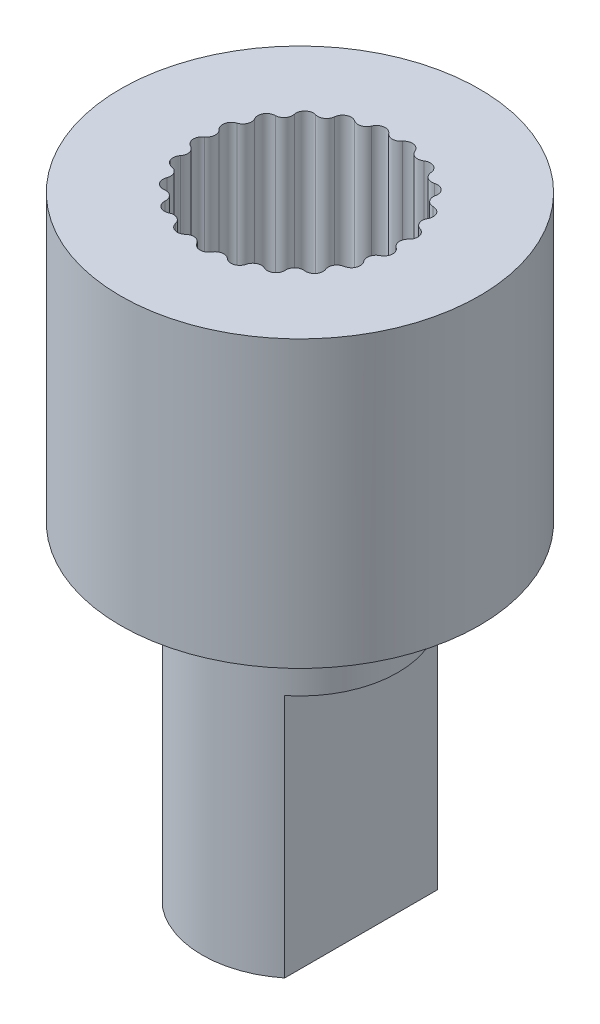
from build123d import *

# Parameters (mm, degrees)
SKETCH1_R           = 3.95
BOSS_EXTRUDE1_DEPTH = 5
SKETCH2_R           = 4.4
BOSS_EXTRUDE2_DEPTH = 2
SKETCH4_R           = 2.4
BOSS_EXTRUDE3_DEPTH = 2
BOSS_EXTRUDE4_DEPTH = 6
SKETCH6_R           = 4.4
SKETCH6_R_2         = 3.95
BOSS_EXTRUDE5_DEPTH = 5


with BuildPart() as part:
    # Sketch1 → Boss-Extrude1 (new body)
    with BuildSketch(Plane(origin=(0, 0, 0), x_dir=(1, 0, 0), z_dir=(0, 1, 0))):
        with Locations(Location((0, 0, 0), (0, 0, 270))):
            Circle(SKETCH1_R)
        with BuildLine():
            ThreePointArc((-0.166646614, 2.345141313), (-0.092401566, 2.286261662), (0, 2.2652595))
            ThreePointArc((0, 2.2652595), (0.092401566, 2.286261662), (0.166646614, 2.345141313))
            ThreePointArc((0.166646614, 2.345141313), (0.365153552, 2.422635524), (0.531999564, 2.290073216))
            ThreePointArc((0.531999564, 2.290073216), (0.585591031, 2.211925311), (0.667696959, 2.164620376))
            ThreePointArc((0.667696959, 2.164620376), (0.762183879, 2.157453631), (0.850485509, 2.191833312))
            ThreePointArc((0.850485509, 2.191833312), (1.063015161, 2.207373726), (1.183375246, 2.031522064))
            ThreePointArc((1.183375246, 2.031522064), (1.211551295, 1.941049689), (1.276066113, 1.871645232))
            ThreePointArc((1.276066113, 1.871645232), (1.364242809, 1.836946378), (1.458755034, 1.843771303))
            ThreePointArc((1.458755034, 1.843771303), (1.666423208, 1.795977086), (1.729602845, 1.592461261))
            ThreePointArc((1.729602845, 1.592461261), (1.72985991, 1.497703284), (1.771051193, 1.412366197))
            ThreePointArc((1.771051193, 1.412366197), (1.845082779, 1.353218377), (1.937407773, 1.331882123))
            ThreePointArc((1.937407773, 1.331882123), (2.121762239, 1.225), (2.12214764, 1.011903287))
            ThreePointArc((2.12214764, 1.011903287), (2.094462881, 0.92127937), (2.108670602, 0.827592226))
            ThreePointArc((2.108670602, 0.827592226), (2.161979047, 0.749250985), (2.243913329, 0.701649371))
            ThreePointArc((2.243913329, 0.701649371), (2.388573385, 0.545176288), (2.326130305, 0.341433266))
            ThreePointArc((2.326130305, 0.341433266), (2.272963633, 0.262995741), (2.258925375, 0.169283054))
            ThreePointArc((2.258925375, 0.169283054), (2.286773988, 0.078709355), (2.351037339, 0.009071994))
            ThreePointArc((2.351037339, 0.009071994), (2.443149303, -0.183088729), (2.323426084, -0.3593746))
            ThreePointArc((2.323426084, -0.3593746), (2.249501592, -0.418656214), (2.208464714, -0.504067659))
            ThreePointArc((2.208464714, -0.504067659), (2.208379026, -0.598825947), (2.249261363, -0.68431147))
            ThreePointArc((2.249261363, -0.68431147), (2.280640684, -0.89508551), (2.114275259, -1.028250455))
            ThreePointArc((2.114275259, -1.028250455), (2.026161462, -1.063108727), (1.961772273, -1.13262975))
            ThreePointArc((1.961772273, -1.13262975), (1.933759896, -1.223152935), (1.947628645, -1.316890857))
            ThreePointArc((1.947628645, -1.316890857), (1.915487132, -1.527550015), (1.717261799, -1.605761745))
            ThreePointArc((1.717261799, -1.605761745), (1.622787995, -1.613099364), (1.540767756, -1.660552716))
            ThreePointArc((1.540767756, -1.660552716), (1.487317713, -1.738797417), (1.472940575, -1.832458712))
            ThreePointArc((1.472940575, -1.832458712), (1.380134142, -2.024284997), (1.167662092, -2.040594058))
            ThreePointArc((1.167662092, -2.040594058), (1.075222693, -2.019759044), (0.982859262, -2.040928287))
            ThreePointArc((0.982859262, -2.040928287), (0.908720824, -2.099942118), (0.86737527, -2.185204569))
            ThreePointArc((0.86737527, -2.185204569), (0.722150177, -2.341153374), (0.514310485, -2.294110633))
            ThreePointArc((0.514310485, -2.294110633), (0.432119136, -2.246954269), (0.337619409, -2.239958423))
            ThreePointArc((0.337619409, -2.239958423), (0.249380102, -2.274497747), (0.184739867, -2.343785411))
            ThreePointArc((0.184739867, -2.343785411), (0, -2.45), (-0.184739867, -2.343785411))
            ThreePointArc((-0.184739867, -2.343785411), (-0.249380102, -2.274497747), (-0.337619409, -2.239958423))
            ThreePointArc((-0.337619409, -2.239958423), (-0.432119136, -2.246954269), (-0.514310485, -2.294110633))
            ThreePointArc((-0.514310485, -2.294110633), (-0.722150177, -2.341153374), (-0.86737527, -2.185204569))
            ThreePointArc((-0.86737527, -2.185204569), (-0.908720824, -2.099942118), (-0.982859262, -2.040928287))
            ThreePointArc((-0.982859262, -2.040928287), (-1.075222693, -2.019759044), (-1.167662092, -2.040594058))
            ThreePointArc((-1.167662092, -2.040594058), (-1.380134142, -2.024284997), (-1.472940575, -1.832458712))
            ThreePointArc((-1.472940575, -1.832458712), (-1.487317713, -1.738797417), (-1.540767756, -1.660552716))
            ThreePointArc((-1.540767756, -1.660552716), (-1.622787995, -1.613099364), (-1.717261799, -1.605761745))
            ThreePointArc((-1.717261799, -1.605761745), (-1.915487132, -1.527550015), (-1.947628645, -1.316890857))
            ThreePointArc((-1.947628645, -1.316890857), (-1.933759896, -1.223152935), (-1.961772273, -1.13262975))
            ThreePointArc((-1.961772273, -1.13262975), (-2.026161462, -1.063108727), (-2.114275259, -1.028250455))
            ThreePointArc((-2.114275259, -1.028250455), (-2.280640684, -0.89508551), (-2.249261363, -0.68431147))
            ThreePointArc((-2.249261363, -0.68431147), (-2.208379026, -0.598825947), (-2.208464714, -0.504067659))
            ThreePointArc((-2.208464714, -0.504067659), (-2.249501592, -0.418656214), (-2.323426084, -0.3593746))
            ThreePointArc((-2.323426084, -0.3593746), (-2.443149303, -0.183088729), (-2.351037339, 0.009071994))
            ThreePointArc((-2.351037339, 0.009071994), (-2.286773988, 0.078709355), (-2.258925375, 0.169283054))
            ThreePointArc((-2.258925375, 0.169283054), (-2.272963633, 0.262995741), (-2.326130305, 0.341433266))
            ThreePointArc((-2.326130305, 0.341433266), (-2.388573385, 0.545176288), (-2.243913329, 0.701649371))
            ThreePointArc((-2.243913329, 0.701649371), (-2.161979047, 0.749250985), (-2.108670602, 0.827592226))
            ThreePointArc((-2.108670602, 0.827592226), (-2.094462881, 0.92127937), (-2.12214764, 1.011903287))
            ThreePointArc((-2.12214764, 1.011903287), (-2.121762239, 1.225), (-1.937407773, 1.331882123))
            ThreePointArc((-1.937407773, 1.331882123), (-1.845082779, 1.353218377), (-1.771051193, 1.412366197))
            ThreePointArc((-1.771051193, 1.412366197), (-1.72985991, 1.497703284), (-1.729602845, 1.592461261))
            ThreePointArc((-1.729602845, 1.592461261), (-1.666423208, 1.795977086), (-1.458755034, 1.843771303))
            ThreePointArc((-1.458755034, 1.843771303), (-1.364242809, 1.836946378), (-1.276066113, 1.871645232))
            ThreePointArc((-1.276066113, 1.871645232), (-1.211551295, 1.941049689), (-1.183375246, 2.031522064))
            ThreePointArc((-1.183375246, 2.031522064), (-1.063015161, 2.207373726), (-0.850485509, 2.191833312))
            ThreePointArc((-0.850485509, 2.191833312), (-0.762183879, 2.157453631), (-0.667696959, 2.164620376))
            ThreePointArc((-0.667696959, 2.164620376), (-0.585591031, 2.211925311), (-0.531999564, 2.290073216))
            ThreePointArc((-0.531999564, 2.290073216), (-0.365153552, 2.422635524), (-0.166646614, 2.345141313))
        make_face(mode=Mode.SUBTRACT)
    extrude(amount=BOSS_EXTRUDE1_DEPTH)

    # Sketch2 → Boss-Extrude2 (add)
    with BuildSketch(Plane.XZ):
        with Locations(Location((0, 0, 0), (0, 0, 270))):
            Circle(SKETCH2_R)
    extrude(amount=BOSS_EXTRUDE2_DEPTH)

    # Sketch4 → Boss-Extrude3 (add)
    with BuildSketch(Plane.XZ.offset(2)):
        with Locations(Location((0, 0, 0), (0, 0, 270))):
            Circle(SKETCH4_R)
    extrude(amount=BOSS_EXTRUDE3_DEPTH)

    # Sketch5 → Boss-Extrude4 (add)
    with BuildSketch(Plane.XZ.offset(4)):
        with BuildLine():
            ThreePointArc((1.5, 1.8734994), (0, 2.4), (-1.5, 1.8734994))
            Line((-1.5, 1.8734994), (-1.5, -1.8734994))
            ThreePointArc((-1.5, -1.8734994), (0, -2.4), (1.5, -1.8734994))
            Line((1.5, -1.8734994), (1.5, 1.8734994))
        make_face()
    extrude(amount=BOSS_EXTRUDE4_DEPTH)

    # Sketch6 → Boss-Extrude5 (add)
    with BuildSketch(Plane(origin=(0, 0, 0), x_dir=(1, 0, 0), z_dir=(0, 1, 0))):
        with Locations(Location((0, 0, 0), (0, 0, 270))):
            Circle(SKETCH6_R)
        Circle(SKETCH6_R_2, mode=Mode.SUBTRACT)
    extrude(amount=BOSS_EXTRUDE5_DEPTH)


solid = part.part
